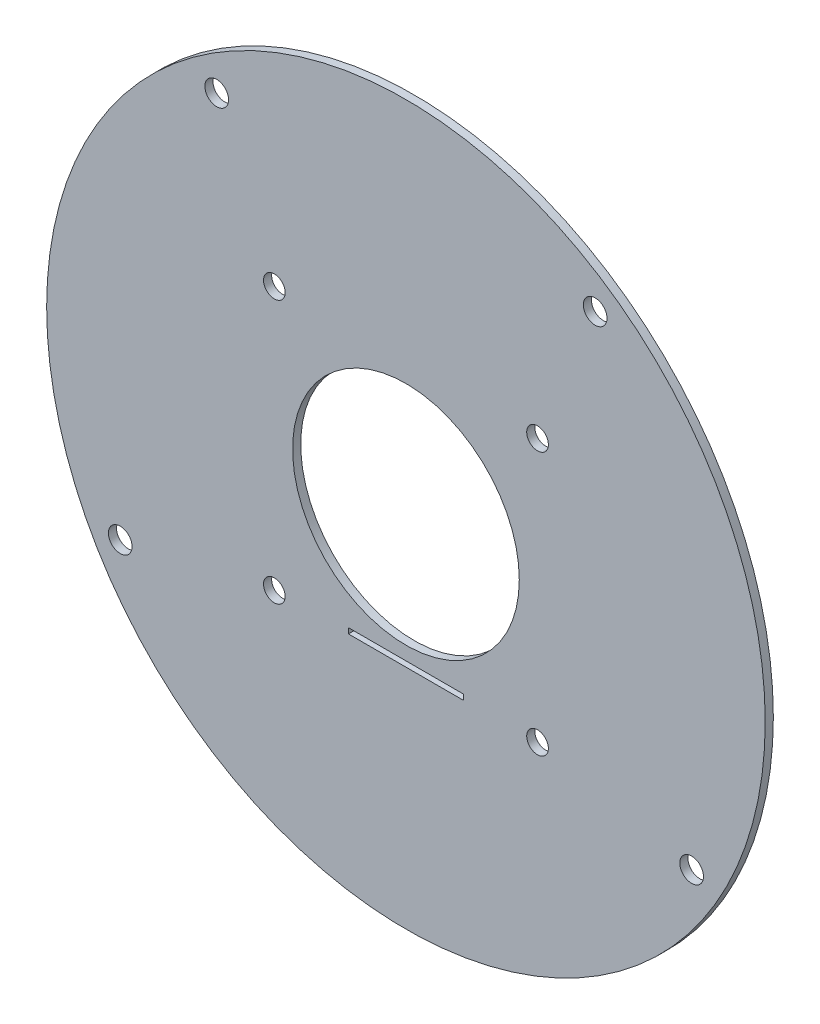
from build123d import *

# Parameters (mm, degrees)
SKETCH3_R              = 53.091965393
SKETCH3_R_2            = 16.75054858
PCB_DEPTH              = 1.2
MAST_REACH             = 77.093
SKETCH5_R              = 1.6
ENCLOSURE_SCREWS_REACH = 77.093
SKETCH6_R              = 1.75
FLEX_CABLE_REACH       = 77.093
SKETCH9_W              = 17
SKETCH9_H              = 0.8


with BuildPart() as part:
    # Sketch3 → PCB (new body)
    with BuildSketch(Plane.XY):
        Circle(SKETCH3_R)
        Circle(SKETCH3_R_2, mode=Mode.SUBTRACT)
    extrude(amount=PCB_DEPTH)

    # Sketch5 → Mast (cut, up to next)
    with BuildSketch(Plane.XY.offset(1.2), mode=Mode.PRIVATE) as mast_sk1:
        with Locations((-19.445436483, -19.445436483)):
            Circle(SKETCH5_R)
    mast_tool1 = extrude(mast_sk1.sketch, amount=-MAST_REACH, mode=Mode.PRIVATE) & part.part
    # Sketch5 → Mast (cut, up to next)
    with BuildSketch(Plane.XY.offset(1.2), mode=Mode.PRIVATE) as mast_sk2:
        with Locations((-19.445436483, 19.445436483)):
            Circle(SKETCH5_R)
    mast_tool2 = extrude(mast_sk2.sketch, amount=-MAST_REACH, mode=Mode.PRIVATE) & part.part
    # Sketch5 → Mast (cut, up to next)
    with BuildSketch(Plane.XY.offset(1.2), mode=Mode.PRIVATE) as mast_sk3:
        with Locations((19.445436483, 19.445436483)):
            Circle(SKETCH5_R)
    mast_tool3 = extrude(mast_sk3.sketch, amount=-MAST_REACH, mode=Mode.PRIVATE) & part.part
    # Sketch5 → Mast (cut, up to next)
    with BuildSketch(Plane.XY.offset(1.2), mode=Mode.PRIVATE) as mast_sk4:
        with Locations((19.445436483, -19.445436483)):
            Circle(SKETCH5_R)
    mast_tool4 = extrude(mast_sk4.sketch, amount=-MAST_REACH, mode=Mode.PRIVATE) & part.part
    add(mast_tool1.solids().sort_by_distance((-19.445436, -19.445436, 1.2))[0], mode=Mode.SUBTRACT)
    add(mast_tool2.solids().sort_by_distance((-19.445436, 19.445436, 1.2))[0], mode=Mode.SUBTRACT)
    add(mast_tool3.solids().sort_by_distance((19.445436, 19.445436, 1.2))[0], mode=Mode.SUBTRACT)
    add(mast_tool4.solids().sort_by_distance((19.445436, -19.445436, 1.2))[0], mode=Mode.SUBTRACT)

    # Sketch6 → Enclosure screws (cut, up to next)
    with BuildSketch(Plane.XY.offset(1.2), mode=Mode.PRIVATE) as enclosure_screws_sk1:
        with Locations((27.960647328, 39.931942749)):
            Circle(SKETCH6_R)
    enclosure_screws_tool1 = extrude(enclosure_screws_sk1.sketch, amount=-ENCLOSURE_SCREWS_REACH, mode=Mode.PRIVATE) & part.part
    # Sketch6 → Enclosure screws (cut, up to next)
    with BuildSketch(Plane.XY.offset(1.2), mode=Mode.PRIVATE) as enclosure_screws_sk2:
        with Locations((42.216920637, -24.373950494)):
            Circle(SKETCH6_R)
    enclosure_screws_tool2 = extrude(enclosure_screws_sk2.sketch, amount=-ENCLOSURE_SCREWS_REACH, mode=Mode.PRIVATE) & part.part
    # Sketch6 → Enclosure screws (cut, up to next)
    with BuildSketch(Plane.XY.offset(1.2), mode=Mode.PRIVATE) as enclosure_screws_sk3:
        with Locations((-42.216920637, -24.373950494)):
            Circle(SKETCH6_R)
    enclosure_screws_tool3 = extrude(enclosure_screws_sk3.sketch, amount=-ENCLOSURE_SCREWS_REACH, mode=Mode.PRIVATE) & part.part
    # Sketch6 → Enclosure screws (cut, up to next)
    with BuildSketch(Plane.XY.offset(1.2), mode=Mode.PRIVATE) as enclosure_screws_sk4:
        with Locations((-27.960647328, 39.931942749)):
            Circle(SKETCH6_R)
    enclosure_screws_tool4 = extrude(enclosure_screws_sk4.sketch, amount=-ENCLOSURE_SCREWS_REACH, mode=Mode.PRIVATE) & part.part
    add(enclosure_screws_tool1.solids().sort_by_distance((27.960647, 39.931943, 1.2))[0], mode=Mode.SUBTRACT)
    add(enclosure_screws_tool2.solids().sort_by_distance((42.216921, -24.37395, 1.2))[0], mode=Mode.SUBTRACT)
    add(enclosure_screws_tool3.solids().sort_by_distance((-42.216921, -24.37395, 1.2))[0], mode=Mode.SUBTRACT)
    add(enclosure_screws_tool4.solids().sort_by_distance((-27.960647, 39.931943, 1.2))[0], mode=Mode.SUBTRACT)

    # Sketch9 → Flex cable (cut, up to next)
    with BuildSketch(Plane.XY, mode=Mode.PRIVATE) as flex_cable_sk1:
        with Locations((0, -19.15054858)):
            Rectangle(SKETCH9_W, SKETCH9_H)
    flex_cable_tool1 = extrude(flex_cable_sk1.sketch, amount=FLEX_CABLE_REACH, mode=Mode.PRIVATE) & part.part
    add(flex_cable_tool1.solids().sort_by_distance((0, -19.150549, 0))[0], mode=Mode.SUBTRACT)


solid = part.part
